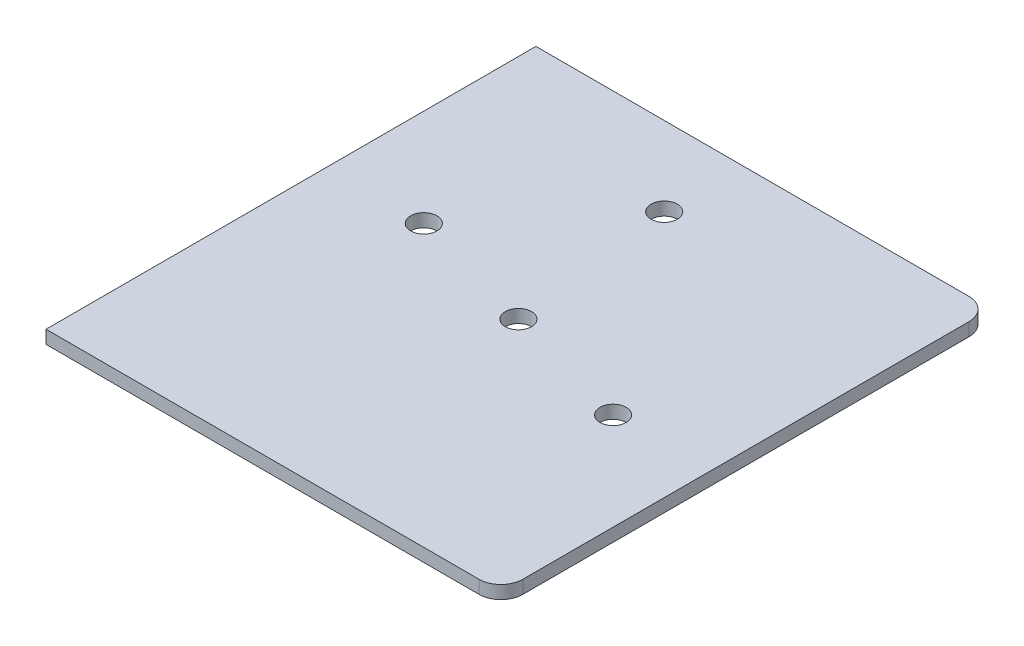
from build123d import *

# Parameters (mm, degrees)
BOSS_EXTRUDE1_DEPTH = 9.525
BOSS_EXTRUDE2_DEPTH = 9.525
SKETCH3_R           = 9.525
CUT_EXTRUDE6_DEPTH  = 587.481888574
FILLET1_R           = 15.875


with BuildPart() as part:
    # Sketch1 → Boss-Extrude1 (new body)
    with BuildSketch(Plane(origin=(0, 0, 0), x_dir=(1, 0, 0), z_dir=(0, 1, 0))):
        Polygon((461.512355724, 17.636671785), (558.8, 99.270698215), (558.8, 177.8), (228.6, 177.8), (228.6, -177.8), align=None)
    extrude(amount=BOSS_EXTRUDE1_DEPTH)

    # Sketch1<4> → Boss-Extrude2 (add)
    with BuildSketch(Plane(origin=(0, 0, 0), x_dir=(1, 0, 0), z_dir=(0, 1, 0))):
        Polygon((558.8, -177.8), (558.8, 99.270698215), (461.512355724, 17.636671785), (228.6, -177.8), align=None)
    extrude(amount=BOSS_EXTRUDE2_DEPTH)

    # Sketch3 → Cut-Extrude6 (cut, through all)
    with BuildSketch(Plane.XZ):
        with Locations((393.7, 0)):
            Circle(SKETCH3_R)
        with Locations((379.081065176, -120.432550602)):
            Circle(SKETCH3_R)
        with Locations((299.157266994, -25.855507357)):
            Circle(SKETCH3_R)
        with Locations((488.242733006, 25.855507357)):
            Circle(SKETCH3_R)
    extrude(amount=-CUT_EXTRUDE6_DEPTH, mode=Mode.SUBTRACT)

    # Fillet1
    fillet1_edges = [part.edges().sort_by_distance(p)[0] for p in [
        (558.8, 4.7625, 177.8),
        (558.8, 4.7625, -177.8),
    ]]
    fillet(fillet1_edges, radius=FILLET1_R)


solid = part.part
